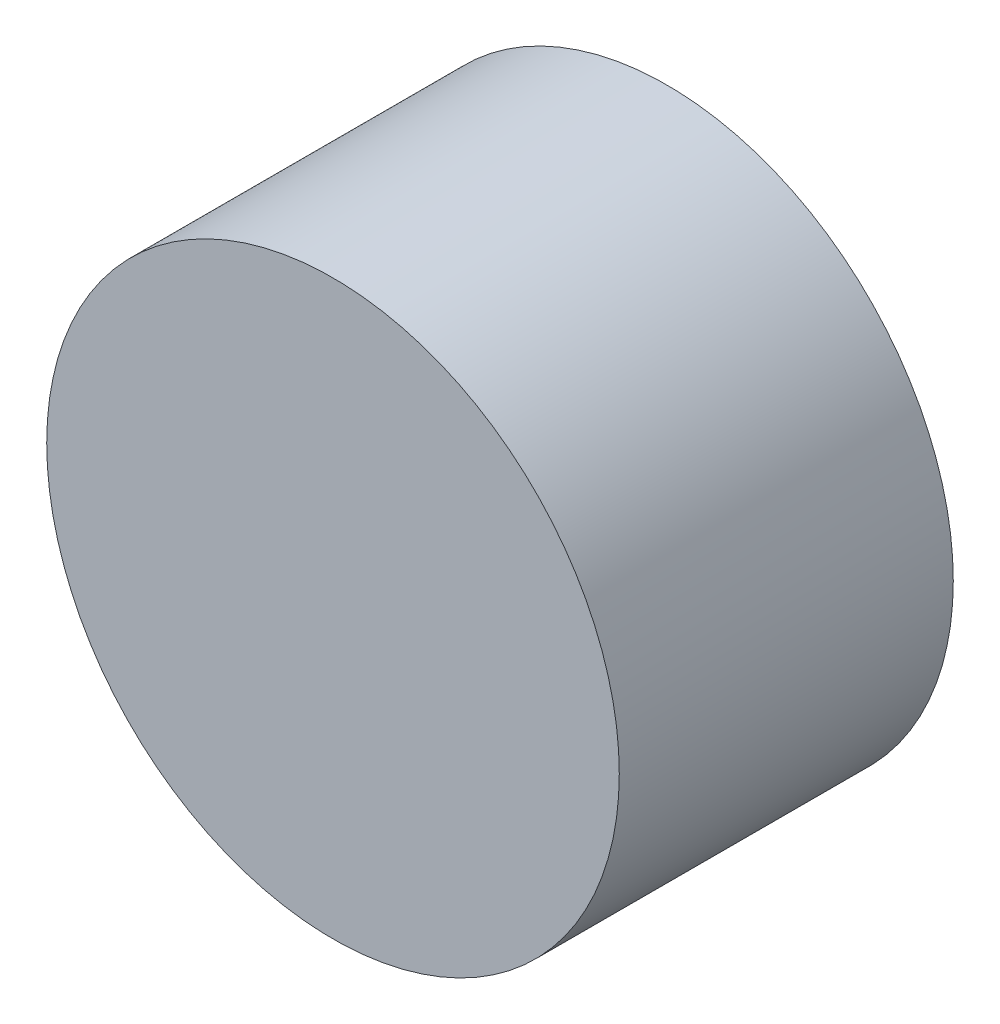
from build123d import *

# Parameters (mm, degrees)
SKETCH_1_R      = 240
EXTRUDE_1_DEPTH = 280


with BuildPart() as part:
    # 草图1 → 凸台-拉伸1 (new body)
    with BuildSketch(Plane.XY):
        Circle(SKETCH_1_R)
    extrude(amount=EXTRUDE_1_DEPTH)


solid = part.part
